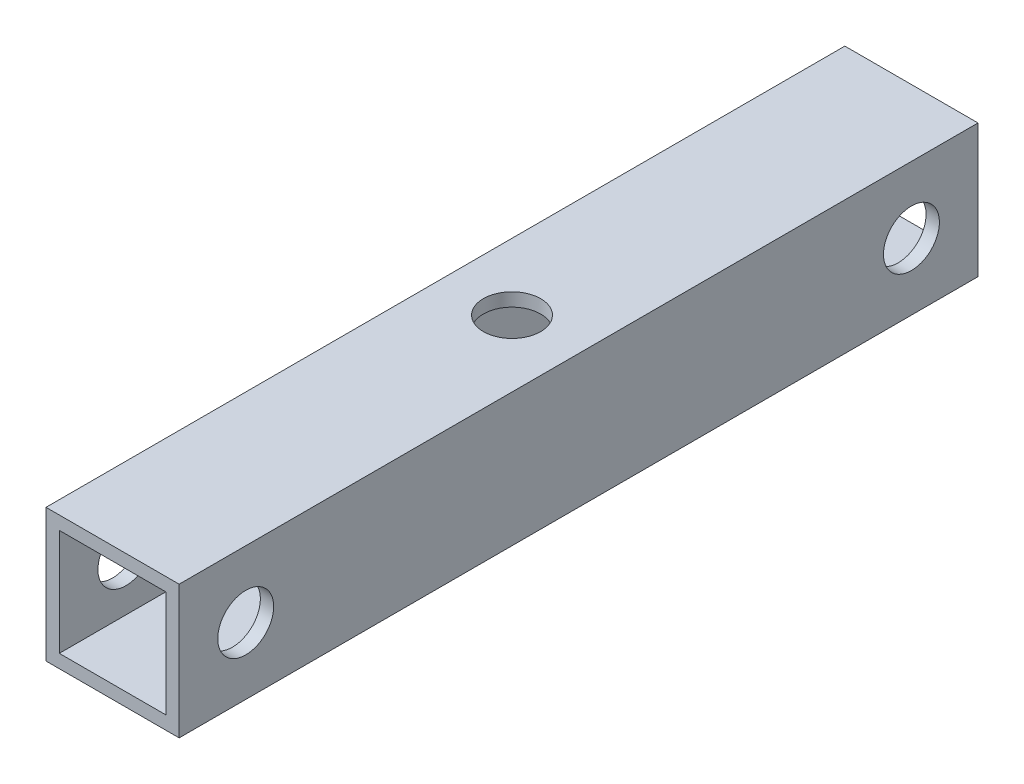
from build123d import *

# Parameters (mm, degrees)
SKETCH_1_W          = 10
SKETCH_1_H          = 10
SKETCH_1_W_2        = 8
SKETCH_1_H_2        = 8
EXTRUDE_1_DEPTH     = 60
CUT_EXTRUDE_1_REACH = 63.644
SKETCH_2_R          = 2.1
CUT_EXTRUDE_2_REACH = 63.644
SKETCH_3_R          = 2.15


with BuildPart() as part:
    # ｽｹｯﾁ1 → 押し出し-薄板1 (new body)
    with BuildSketch(Plane.XY):
        with Locations((5, 5)):
            Rectangle(SKETCH_1_W, SKETCH_1_H)
        with Locations((5, 5)):
            Rectangle(SKETCH_1_W_2, SKETCH_1_H_2, mode=Mode.SUBTRACT)
    extrude(amount=EXTRUDE_1_DEPTH)

    # ｶｯﾄ - 押し出し1: up to this face of the body (flat: up to its plane)
    cut_extrude_1_end = Plane(part.part.faces().sort_by_distance((0, 5, 30))[0])
    # ｽｹｯﾁ2 → ｶｯﾄ - 押し出し1 (cut, up to the picked face)
    with BuildSketch(Plane(origin=(10, 0, 0), x_dir=(0, 0, -1), z_dir=(1, 0, 0)), mode=Mode.PRIVATE) as cut_extrude_1_sk1:
        with Locations(Location((-55, 5, 0), (0, 0, 90))):
            Circle(SKETCH_2_R)
    cut_extrude_1_tool1 = split(extrude(cut_extrude_1_sk1.sketch, amount=-CUT_EXTRUDE_1_REACH, mode=Mode.PRIVATE), bisect_by=cut_extrude_1_end, keep=Keep.BOTH, mode=Mode.PRIVATE)
    # ｽｹｯﾁ2 → ｶｯﾄ - 押し出し1 (cut, up to the picked face)
    with BuildSketch(Plane(origin=(10, 0, 0), x_dir=(0, 0, -1), z_dir=(1, 0, 0)), mode=Mode.PRIVATE) as cut_extrude_1_sk2:
        with Locations(Location((-5, 5, 0), (0, 0, 270))):
            Circle(SKETCH_2_R)
    cut_extrude_1_tool2 = split(extrude(cut_extrude_1_sk2.sketch, amount=-CUT_EXTRUDE_1_REACH, mode=Mode.PRIVATE), bisect_by=cut_extrude_1_end, keep=Keep.BOTH, mode=Mode.PRIVATE)
    add(cut_extrude_1_tool1.solids().sort_by(Axis((10, 5, 55), (-1, 0, 0)))[0], mode=Mode.SUBTRACT)
    add(cut_extrude_1_tool2.solids().sort_by(Axis((10, 5, 5), (-1, 0, 0)))[0], mode=Mode.SUBTRACT)

    # ｶｯﾄ - 押し出し2: up to this face of the body (flat: up to its plane)
    cut_extrude_2_end = Plane(part.part.faces().sort_by_distance((5, 0, 30))[0])
    # ｽｹｯﾁ3 → ｶｯﾄ - 押し出し2 (cut, up to the picked face)
    with BuildSketch(Plane(origin=(0, 10, 0), x_dir=(1, 0, 0), z_dir=(0, 1, 0)), mode=Mode.PRIVATE) as cut_extrude_2_sk1:
        with Locations(Location((5, -30, 0), (0, 0, 270))):
            Circle(SKETCH_3_R)
    cut_extrude_2_tool1 = split(extrude(cut_extrude_2_sk1.sketch, amount=-CUT_EXTRUDE_2_REACH, mode=Mode.PRIVATE), bisect_by=cut_extrude_2_end, keep=Keep.BOTH, mode=Mode.PRIVATE)
    add(cut_extrude_2_tool1.solids().sort_by(Axis((5, 10, 30), (0, -1, 0)))[0], mode=Mode.SUBTRACT)


solid = part.part
